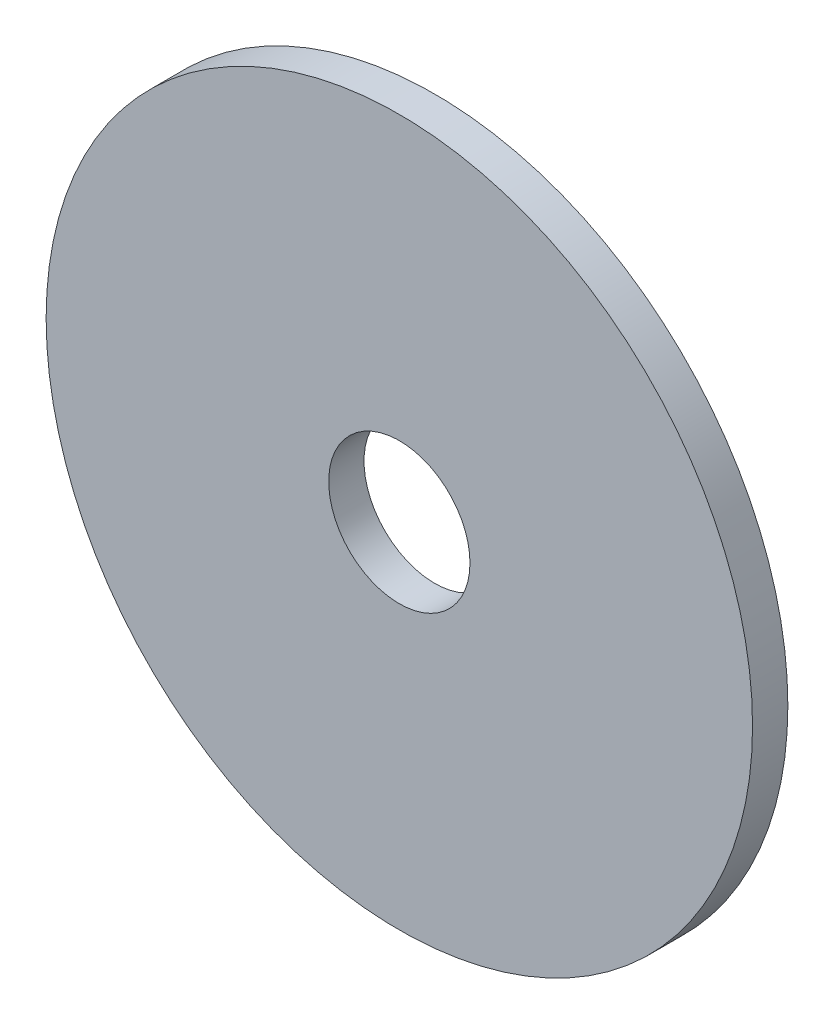
from build123d import *

# Parameters (mm, degrees)
SKETCH1_R           = 50
SKETCH1_R_2         = 10
BOSS_EXTRUDE1_DEPTH = 5


with BuildPart() as part:
    # Sketch1 → Boss-Extrude1 (new body)
    with BuildSketch(Plane.XY):
        Circle(SKETCH1_R)
        Circle(SKETCH1_R_2, mode=Mode.SUBTRACT)
    extrude(amount=BOSS_EXTRUDE1_DEPTH)


solid = part.part
